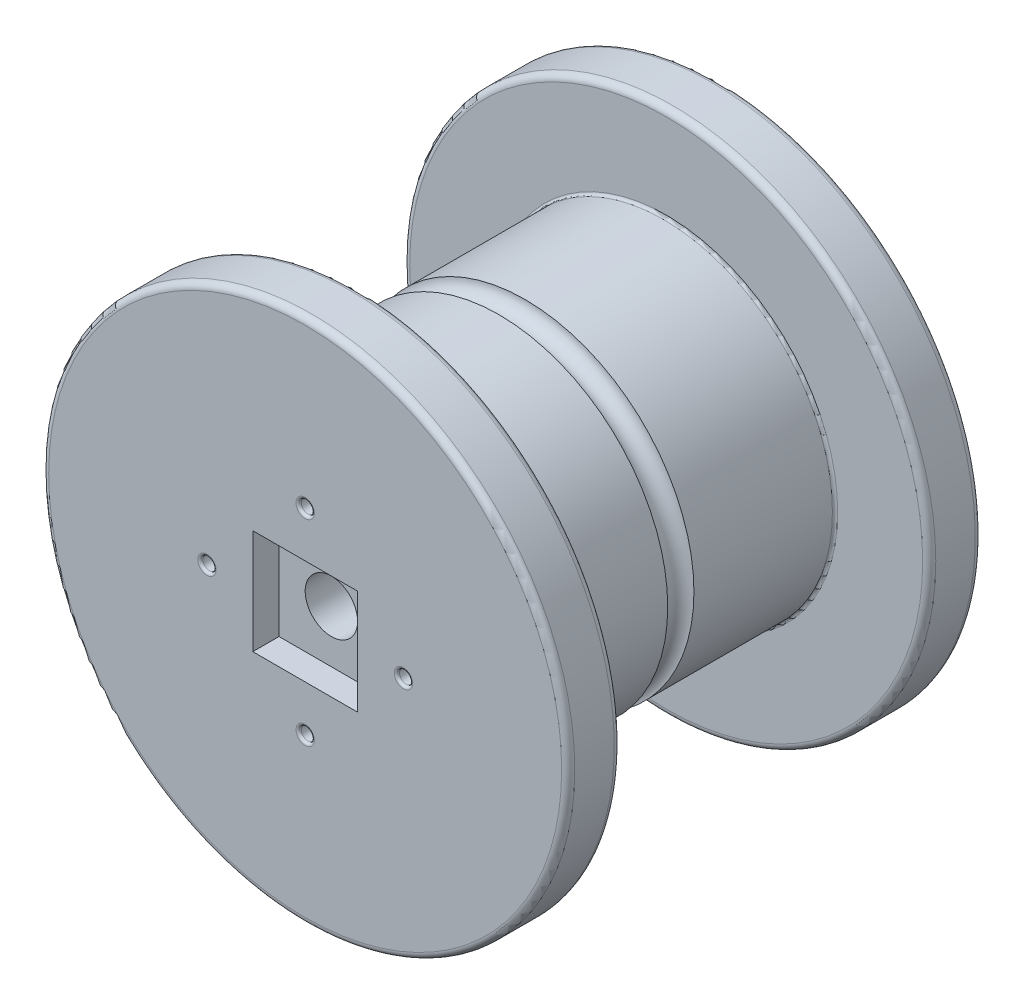
from build123d import *

# Parameters (mm, degrees)
SKETCH2_W          = 101.6
SKETCH2_H          = 101.6
CUT_EXTRUDE1_DEPTH = 25.4
SKETCH3_R          = 25.4
SKETCH3_R_2        = 6.35
CUT_EXTRUDE3_DEPTH = 540.306035568
CIRPATTERN1_COUNT  = 4
FILLET1_R          = 6.35
FILLET2_R          = 2.54


with BuildPart() as part:
    # Sketch1 → Revolve1 (revolve)
    with BuildSketch(Plane(origin=(0, 0, 0), x_dir=(0, 0, -1), z_dir=(1, 0, 0)), mode=Mode.PRIVATE) as revolve1_sk:
        with BuildLine():
            Line((-200.5, 19.05), (187.5, 19.05))
            Line((187.5, 19.05), (187.5, 44.45))
            Line((187.5, 44.45), (200.5, 44.45))
            Line((200.5, 44.45), (200.5, 255))
            Line((200.5, 255), (149.5, 255))
            Line((149.5, 255), (149.5, 163.6903))
            Line((149.5, 163.6903), (12.7, 163.6903))
            ThreePointArc((12.7, 163.6903), (0, 150.9903), (-12.7, 163.6903))
            Line((-12.7, 163.6903), (-149.5, 163.6903))
            Line((-149.5, 163.6903), (-149.5, 255))
            Line((-149.5, 255), (-200.5, 255))
            Line((-200.5, 255), (-200.5, 19.05))
        make_face()
        with BuildLine():
            Line((175.1, 138.2903), (28.398063314, 138.2903))
            ThreePointArc((28.398063314, 138.2903), (21.211687606, 132.041061322), (12.7, 127.769275516))
            Line((12.7, 127.769275516), (12.7, 44.45))
            Line((12.7, 44.45), (162.1, 44.45))
            Line((162.1, 44.45), (162.1, 69.85))
            Line((162.1, 69.85), (175.1, 69.85))
            Line((175.1, 69.85), (175.1, 138.2903))
        make_face(mode=Mode.SUBTRACT)
        with BuildLine():
            Line((-28.398063314, 138.2903), (-149.5, 138.2903))
            Line((-149.5, 138.2903), (-149.5, 44.45))
            Line((-149.5, 44.45), (-12.7, 44.45))
            Line((-12.7, 44.45), (-12.7, 127.769275516))
            ThreePointArc((-12.7, 127.769275516), (-21.211687606, 132.041061322), (-28.398063314, 138.2903))
        make_face(mode=Mode.SUBTRACT)
    revolve(revolve1_sk.sketch.rotate(Axis((0, 0, 0), (0, 0, 1)), 90), axis=Axis((0, 0, 0), (0, 0, 1)))

    # Sketch2 → Cut-Extrude1 (cut)
    with BuildSketch(Plane(origin=(0, 0, 200.5), x_dir=(-1, 0, 0), z_dir=(0, 0, -1))):
        Rectangle(SKETCH2_W, SKETCH2_H)
    extrude(amount=CUT_EXTRUDE1_DEPTH, mode=Mode.SUBTRACT)

    # Sketch3 → Cut-Extrude3 (cut, through all)
    with BuildSketch(Plane.XY.offset(200.5)):
        Circle(SKETCH3_R)
        with Locations((0, 95.25)):
            Circle(SKETCH3_R_2)
    cut_extrude3 = extrude(amount=-CUT_EXTRUDE3_DEPTH, mode=Mode.SUBTRACT)

    # CirPattern1: Cut-Extrude3 ×4 about axis
    cirpattern1_axis = Axis((0, 0, 0), (0, 0, 1))
    for i in range(1, CIRPATTERN1_COUNT):
        add(cut_extrude3.rotate(cirpattern1_axis, i * 360 / CIRPATTERN1_COUNT), mode=Mode.SUBTRACT)

    # Fillet1
    fillet1_edges = [part.edges().sort_by_distance(p)[0] for p in [
        (255, 0, 200.5),
        (255, 0, 149.5),
        (255, 0, -149.5),
        (255, 0, -200.5),
    ]]
    fillet(fillet1_edges, radius=FILLET1_R)

    # Fillet2
    fillet2_edges = [part.edges().sort_by_distance(p)[0] for p in [
        (95.25, 6.35, -200.5),
        (95.25, 6.35, 200.5),
        (6.35, -95.25, -200.5),
        (6.35, -95.25, 200.5),
        (163.6903, 0, 149.5),
        (163.6903, 0, -149.5),
        (44.45, 0, -200.5),
        (44.45, 0, -187.5),
        (-6.35, 95.25, -200.5),
        (-6.35, 95.25, 200.5),
        (-95.25, -6.35, -200.5),
        (-95.25, -6.35, 200.5),
    ]]
    fillet(fillet2_edges, radius=FILLET2_R)


solid = part.part
